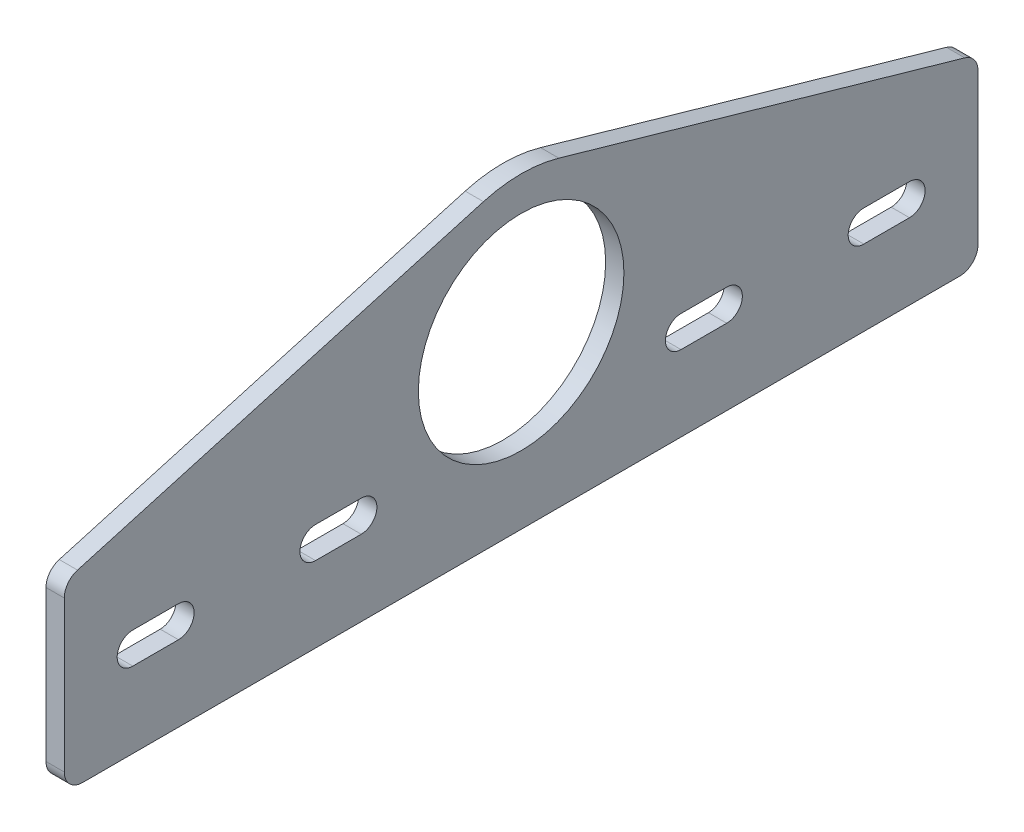
from build123d import *

# Parameters (mm, degrees)
BOSS_EXTRUDE1_DEPTH = 2.54
SKETCH3_R           = 14.2875
CUT_EXTRUDE1_DEPTH  = 68.843323924
FILLET1_R           = 2.54


with BuildPart() as part:
    # Sketch1 → Boss-Extrude1 (new body)
    with BuildSketch(Plane(origin=(0, 0, 0), x_dir=(0, 0, -1), z_dir=(1, 0, 0))):
        with BuildLine():
            Line((-63.5, -23.749), (63.5, -23.749))
            Line((63.5, -23.749), (63.5, 1.651))
            Line((63.5, 1.651), (5.238797024, 18.315499058))
            ThreePointArc((5.238797024, 18.315499058), (0, 19.05), (-5.238797024, 18.315499058))
            Line((-5.238797024, 18.315499058), (-63.5, 1.651))
            Line((-63.5, 1.651), (-63.5, -23.749))
        make_face()
    extrude(amount=BOSS_EXTRUDE1_DEPTH)

    # Sketch3 → Cut-Extrude1 (cut, through all)
    with BuildSketch(Plane.ZY):
        Circle(SKETCH3_R)
        with BuildLine():
            Line((-53.975, -8.8773), (-47.625, -8.8773))
            ThreePointArc((-47.625, -8.8773), (-45.4533, -11.049), (-47.625, -13.2207))
            Line((-47.625, -13.2207), (-53.975, -13.2207))
            ThreePointArc((-53.975, -13.2207), (-56.1467, -11.049), (-53.975, -8.8773))
        make_face()
        with BuildLine():
            Line((-28.575, -8.8773), (-22.225, -8.8773))
            ThreePointArc((-22.225, -8.8773), (-20.0533, -11.049), (-22.225, -13.2207))
            Line((-22.225, -13.2207), (-28.575, -13.2207))
            ThreePointArc((-28.575, -13.2207), (-30.7467, -11.049), (-28.575, -8.8773))
        make_face()
        with BuildLine():
            Line((22.225, -8.8773), (28.575, -8.8773))
            ThreePointArc((28.575, -8.8773), (30.7467, -11.049), (28.575, -13.2207))
            Line((28.575, -13.2207), (22.225, -13.2207))
            ThreePointArc((22.225, -13.2207), (20.0533, -11.049), (22.225, -8.8773))
        make_face()
        with BuildLine():
            Line((47.625, -8.8773), (53.975, -8.8773))
            ThreePointArc((53.975, -8.8773), (56.1467, -11.049), (53.975, -13.2207))
            Line((53.975, -13.2207), (47.625, -13.2207))
            ThreePointArc((47.625, -13.2207), (45.4533, -11.049), (47.625, -8.8773))
        make_face()
    extrude(amount=-CUT_EXTRUDE1_DEPTH, mode=Mode.SUBTRACT)

    # Fillet1
    fillet1_edges = [part.edges().sort_by_distance(p)[0] for p in [
        (1.27, -23.749, 63.5),
        (1.27, 1.651, 63.5),
        (1.27, 1.651, -63.5),
        (1.27, -23.749, -63.5),
    ]]
    fillet(fillet1_edges, radius=FILLET1_R)


solid = part.part
